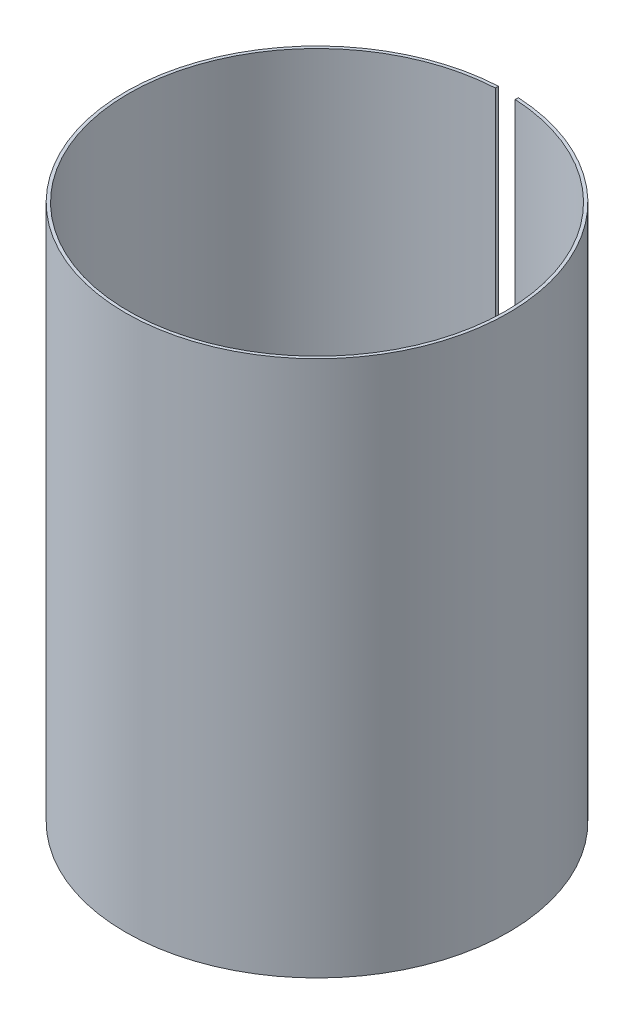
from build123d import *

# Parameters (mm, degrees)
SKETCH1_R           = 62.5
SKETCH1_R_2         = 61.5
BOSS_EXTRUDE1_DEPTH = 87.5
SKETCH2_W           = 6.5
SKETCH2_H           = 1.085934022
CUT_EXTRUDE1_DEPTH  = 197.054839267


with BuildPart() as part:
    # Sketch1 → Boss-Extrude1 (new, symmetric)
    with BuildSketch(Plane(origin=(0, 0, 0), x_dir=(1, 0, 0), z_dir=(0, 1, 0))):
        with Locations(Location((0, 0, 0), (0, 0, 270))):
            Circle(SKETCH1_R)
        with Locations(Location((0, 0, 0), (0, 0, 270))):
            Circle(SKETCH1_R_2, mode=Mode.SUBTRACT)
    extrude(amount=BOSS_EXTRUDE1_DEPTH, both=True)

    # Sketch2 → Cut-Extrude1 (cut, through all)
    with BuildSketch(Plane(origin=(0, 87.5, 0), x_dir=(1, 0, 0), z_dir=(0, 1, 0))):
        with Locations((0, 61.957032989)):
            Rectangle(SKETCH2_W, SKETCH2_H)
    extrude(amount=-CUT_EXTRUDE1_DEPTH, mode=Mode.SUBTRACT)


solid = part.part
